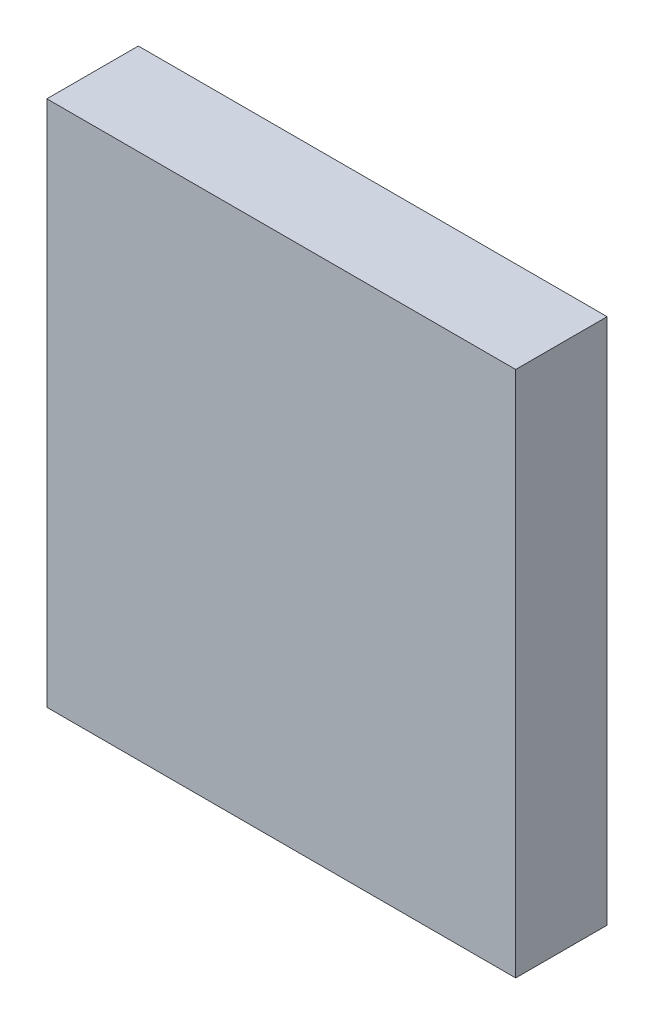
from build123d import *

# Parameters (mm, degrees)
SKIZZE1_W               = 5.127
SKIZZE1_H               = 5.7635
COMPONENT_OUTLINE_DEPTH = 1


with BuildPart() as part:
    # Skizze1 → Component_Outline (new body)
    with BuildSketch(Plane.XY):
        with Locations((0, 0.31825)):
            Rectangle(SKIZZE1_W, SKIZZE1_H)
    extrude(amount=COMPONENT_OUTLINE_DEPTH)


solid = part.part
